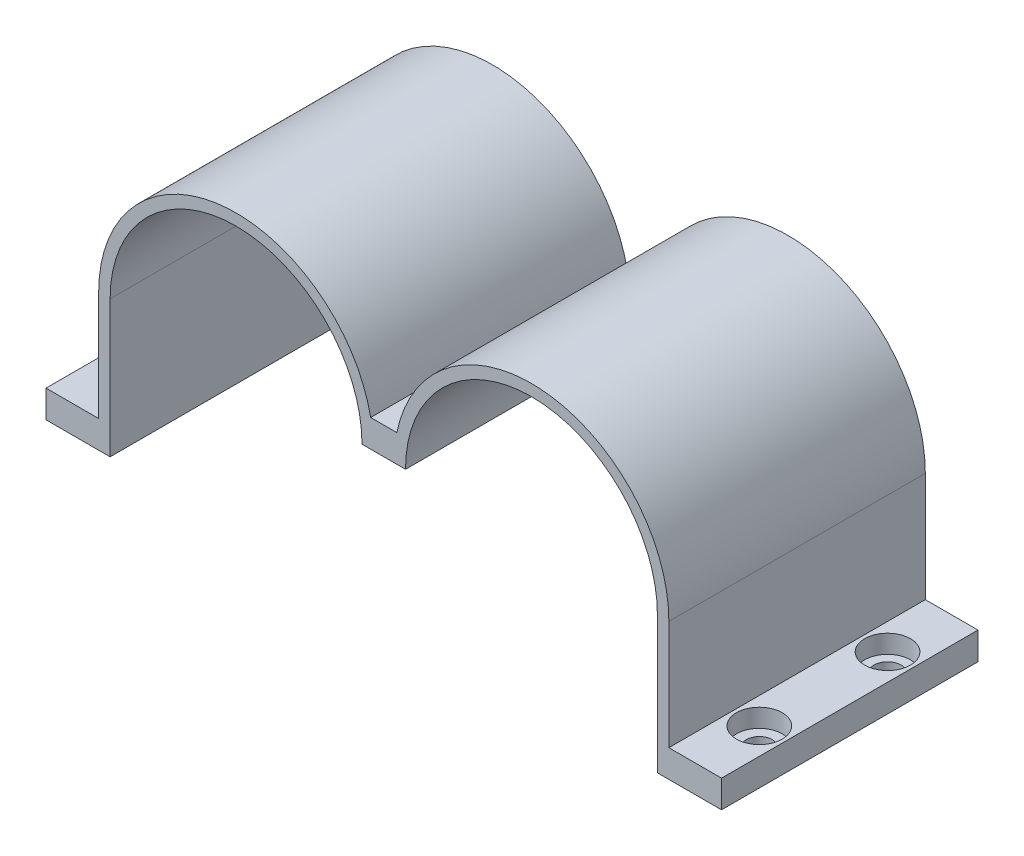
from build123d import *

# Parameters (mm, degrees)
SALIENTE_EXTRUIR1_DEPTH = 28
CROQUIS2_R              = 2.5
CROQUIS2_R_2            = 1.5
CROQUIS2_R_3            = 1.407949101
CORTAR_EXTRUIR1_DEPTH   = 2
CROQUIS3_R              = 1.407949101
CROQUIS3_R_2            = 1.5
CORTAR_EXTRUIR2_DEPTH   = 54.570618198
CROQUIS4_R              = 1.407949101
CROQUIS4_R_2            = 1.5
CORTAR_EXTRUIR3_DEPTH   = 54.570618198


with BuildPart() as part:
    # Croquis1 → Saliente-Extruir1 (new body)
    with BuildSketch(Plane.XY):
        with BuildLine():
            ThreePointArc((-29.875, 0), (-16.125, 13.75), (-2.375, 0))
            Line((-2.375, 0), (-1.125, 0))
            Line((-1.125, 0), (1.125, 0))
            Line((1.125, 0), (2.375, 0))
            ThreePointArc((2.375, 0), (16.125, 13.75), (29.875, 0))
            Line((29.875, 0), (29.875, -9.945231658))
            Line((29.875, -9.945231658), (29.875, -14.945231658))
            Line((29.875, -14.945231658), (36.875, -14.945231658))
            Line((36.875, -14.945231658), (36.875, -11.945231658))
            Line((36.875, -11.945231658), (31.125, -11.945231658))
            Line((31.125, -11.945231658), (31.125, 0))
            ThreePointArc((31.125, 0), (17.63263443, 14.924042295), (1.428061543, 3))
            Line((1.428061543, 3), (-1.428061543, 3))
            ThreePointArc((-1.428061543, 3), (-17.63263443, 14.924042295), (-31.125, 0))
            Line((-31.125, 0), (-31.125, -11.945231658))
            Line((-31.125, -11.945231658), (-36.875, -11.945231658))
            Line((-36.875, -11.945231658), (-36.875, -14.945231658))
            Line((-36.875, -14.945231658), (-29.875, -14.945231658))
            Line((-29.875, -14.945231658), (-29.875, -9.945231658))
            Line((-29.875, -9.945231658), (-29.875, 0))
        make_face()
    extrude(amount=-SALIENTE_EXTRUIR1_DEPTH)

    # Croquis2 → Cortar-Extruir1 (cut)
    # profile 1 of 4: a face of its own
    with BuildSketch(Plane(origin=(0, -11.945231658, 0), x_dir=(1, 0, 0), z_dir=(0, 1, 0))):
        with Locations(Location((-34, 21, 0), (0, 0, 180))):
            Circle(CROQUIS2_R)
        with Locations(Location((-34, 21, 0), (0, 0, 180))):
            Circle(CROQUIS2_R_2, mode=Mode.SUBTRACT)
    # profile 2 of 4: a face of its own
    with BuildSketch(Plane(origin=(0, -11.945231658, 0), x_dir=(1, 0, 0), z_dir=(0, 1, 0))):
        with Locations(Location((-34, 7, 0), (0, 0, 180))):
            Circle(CROQUIS2_R)
        with Locations(Location((-34, 7, 0), (0, 0, 180))):
            Circle(CROQUIS2_R_3, mode=Mode.SUBTRACT)
    # profile 3 of 4: a face of its own
    with BuildSketch(Plane(origin=(0, -11.945231658, 0), x_dir=(1, 0, 0), z_dir=(0, 1, 0))):
        with Locations((34, 7)):
            Circle(CROQUIS2_R)
        with Locations((34, 7)):
            Circle(CROQUIS2_R_3, mode=Mode.SUBTRACT)
    # profile 4 of 4: a face of its own
    with BuildSketch(Plane(origin=(0, -11.945231658, 0), x_dir=(1, 0, 0), z_dir=(0, 1, 0))):
        with Locations((34, 21)):
            Circle(CROQUIS2_R)
        with Locations((34, 21)):
            Circle(CROQUIS2_R_2, mode=Mode.SUBTRACT)
    extrude(amount=-CORTAR_EXTRUIR1_DEPTH, mode=Mode.SUBTRACT)

    # Croquis3 → Cortar-Extruir2 (cut, through all)
    with BuildSketch(Plane(origin=(0, -11.945231658, 0), x_dir=(1, 0, 0), z_dir=(0, 1, 0))):
        with Locations(Location((-34, 7, 0), (0, 0, 180))):
            Circle(CROQUIS3_R)
        with Locations(Location((-34, 21, 0), (0, 0, 180))):
            Circle(CROQUIS3_R_2)
    extrude(amount=-CORTAR_EXTRUIR2_DEPTH, mode=Mode.SUBTRACT)

    # Croquis4 → Cortar-Extruir3 (cut, through all)
    with BuildSketch(Plane(origin=(0, -11.945231658, 0), x_dir=(1, 0, 0), z_dir=(0, 1, 0))):
        with Locations(Location((34, 7, 0), (0, 0, 180))):
            Circle(CROQUIS4_R)
        with Locations(Location((34, 21, 0), (0, 0, 180))):
            Circle(CROQUIS4_R_2)
    extrude(amount=-CORTAR_EXTRUIR3_DEPTH, mode=Mode.SUBTRACT)


solid = part.part
